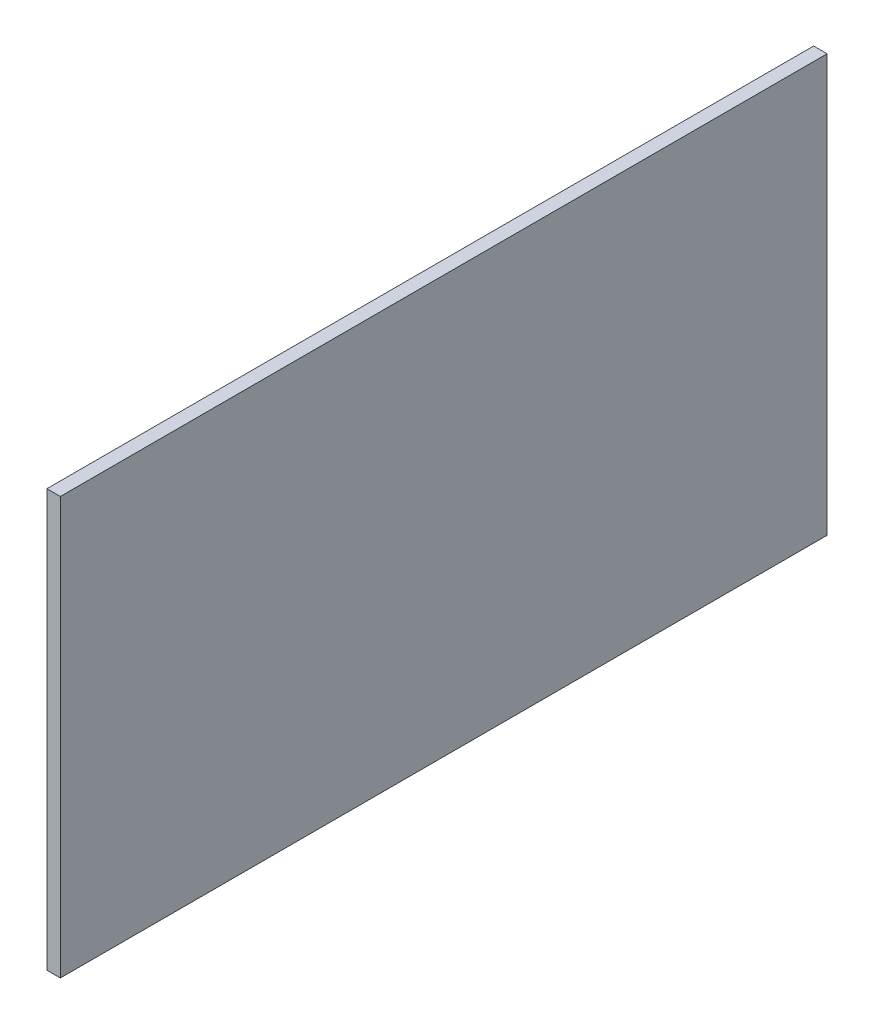
from build123d import *

# Parameters (mm, degrees)
SKETCH2_W           = 1425
SKETCH2_H           = 775
BOSS_EXTRUDE1_DEPTH = 25


with BuildPart() as part:
    # Sketch2 → Boss-Extrude1 (new body)
    with BuildSketch(Plane(origin=(0, 0, 0), x_dir=(0, 0, -1), z_dir=(1, 0, 0))):
        with Locations((712.5, 387.5)):
            Rectangle(SKETCH2_W, SKETCH2_H)
    extrude(amount=BOSS_EXTRUDE1_DEPTH)


solid = part.part
